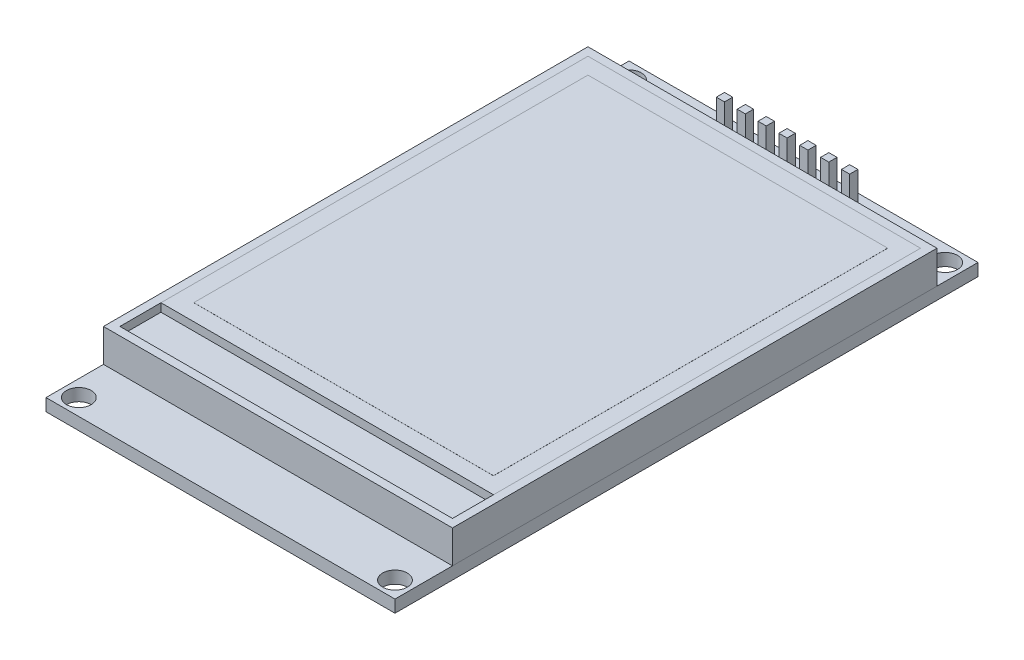
from build123d import *

# Parameters (mm, degrees)
SKETCH1_W                                  = 42.5
SKETCH1_H                                  = 71
BOSS_EXTRUDE1_DEPTH                        = 1.5
SKETCH7_R                                  = 1.5
CUT_EXTRUDE2_DEPTH                         = 42.401237904
MIRROR1_AT_THE_SECOND_PLANE_COPY_1_SKETC_R = 1.5
MIRROR1_AT_THE_SECOND_PLANE_COPY_1_DEPTH   = 42.401237904
BOSS_EXTRUDE5_START                        = -8
SKETCH8_W                                  = 1
SKETCH8_H                                  = 1
BOSS_EXTRUDE5_DEPTH                        = 12
LPATTERN1_COUNT                            = 4
LPATTERN1_PITCH                            = 2.54
LPATTERN1_COL_COUNT                        = 4
LPATTERN1_COL_PITCH                        = 2.54
SKETCH2_W                                  = 42.5
SKETCH2_H                                  = 59
BOSS_EXTRUDE2_DEPTH                        = 4
SKETCH3_W                                  = 40.5
SKETCH3_H                                  = 57
CUT_EXTRUDE1_DEPTH                         = 44.079142285
SKETCH5_W                                  = 40.5
SKETCH5_H                                  = 57
BOSS_EXTRUDE3_DEPTH                        = 4
SKETCH9_W                                  = 40.5
SKETCH9_H                                  = 5
CUT_EXTRUDE3_DEPTH                         = 1
SKETCH6_W                                  = 36.5
SKETCH6_H                                  = 48
BOSS_EXTRUDE4_DEPTH                        = 0.01


with BuildPart() as part:
    # Sketch1 → Boss-Extrude1 (new body)
    with BuildSketch(Plane(origin=(0, 0, 0), x_dir=(1, 0, 0), z_dir=(0, 1, 0))):
        Rectangle(SKETCH1_W, SKETCH1_H)
    extrude(amount=BOSS_EXTRUDE1_DEPTH)

    # Sketch7 → Cut-Extrude2 (cut, through all)
    with BuildSketch(Plane(origin=(0, 1.5, 0), x_dir=(1, 0, 0), z_dir=(0, 1, 0))):
        with Locations(Location((-19.25, 33.5, 0), (0, 0, 270))):
            Circle(SKETCH7_R)
    cut_extrude2 = extrude(amount=-CUT_EXTRUDE2_DEPTH, mode=Mode.SUBTRACT)

    # Mirror1: Cut-Extrude2 across plane
    add(cut_extrude2.mirror(Plane.XY), mode=Mode.SUBTRACT)

    # Mirror1 at the second plane: Cut-Extrude2 across plane
    add(cut_extrude2.mirror(Plane(origin=(0, 0, 0), x_dir=(0, 0, 1), z_dir=(1, 0, 0))), mode=Mode.SUBTRACT)

    # Mirror1 at the second plane copy 1 sketc → Mirror1 at the second plane copy 1 (cut, through all)
    with BuildSketch(Plane(origin=(0, 1.5, 0), x_dir=(-1, 0, 0), z_dir=(0, 1, 0))):
        with Locations(Location((-19.25, 33.5, 0), (0, 0, 270))):
            Circle(MIRROR1_AT_THE_SECOND_PLANE_COPY_1_SKETC_R)
    extrude(amount=-MIRROR1_AT_THE_SECOND_PLANE_COPY_1_DEPTH, mode=Mode.SUBTRACT)

    # Sketch8 → Boss-Extrude5 (add)
    with BuildSketch(Plane(origin=(0, 1.5, 0), x_dir=(1, 0, 0), z_dir=(0, 1, 0)).offset(BOSS_EXTRUDE5_START)):
        with Locations((0, 33.5)):
            Rectangle(SKETCH8_W, SKETCH8_H)
    boss_extrude5 = extrude(amount=BOSS_EXTRUDE5_DEPTH)

    # LPattern1: Boss-Extrude5 ×4
    with Locations(*[(i * LPATTERN1_PITCH, 0, 0) for i in range(1, LPATTERN1_COUNT)]):
        add(boss_extrude5)

    # LPattern1 col: Boss-Extrude5 ×4
    with Locations(*[(-i * LPATTERN1_COL_PITCH, 0, 0) for i in range(1, LPATTERN1_COL_COUNT)]):
        add(boss_extrude5)


with BuildPart() as body_2:
    # Sketch2 → Boss-Extrude2 (new body)
    with BuildSketch(Plane(origin=(0, 1.5, 0), x_dir=(1, 0, 0), z_dir=(0, 1, 0))):
        with Locations((0, 1)):
            Rectangle(SKETCH2_W, SKETCH2_H)
    extrude(amount=BOSS_EXTRUDE2_DEPTH)

    # Sketch3 → Cut-Extrude1 (cut, through all)
    with BuildSketch(Plane(origin=(0, 5.5, 0), x_dir=(1, 0, 0), z_dir=(0, 1, 0))):
        with Locations((0, 1)):
            Rectangle(SKETCH3_W, SKETCH3_H)
    extrude(amount=-CUT_EXTRUDE1_DEPTH, mode=Mode.SUBTRACT)


with BuildPart() as body_3:
    # Sketch5 → Boss-Extrude3 (new body)
    with BuildSketch(Plane(origin=(0, 1.5, 0), x_dir=(1, 0, 0), z_dir=(0, 1, 0))):
        with Locations((0, 1)):
            Rectangle(SKETCH5_W, SKETCH5_H)
    extrude(amount=BOSS_EXTRUDE3_DEPTH)

    # Sketch9 → Cut-Extrude3 (cut)
    with BuildSketch(Plane(origin=(0, 5.5, 0), x_dir=(1, 0, 0), z_dir=(0, 1, 0))):
        with Locations((0, -25)):
            Rectangle(SKETCH9_W, SKETCH9_H)
    extrude(amount=-CUT_EXTRUDE3_DEPTH, mode=Mode.SUBTRACT)

    # Sketch6 → Boss-Extrude4 (add)
    with BuildSketch(Plane(origin=(0, 5.5, 0), x_dir=(1, 0, 0), z_dir=(0, 1, 0))):
        with Locations((0, 3.5)):
            Rectangle(SKETCH6_W, SKETCH6_H)
    extrude(amount=BOSS_EXTRUDE4_DEPTH)


solid = Compound([part.part, body_2.part, body_3.part])
